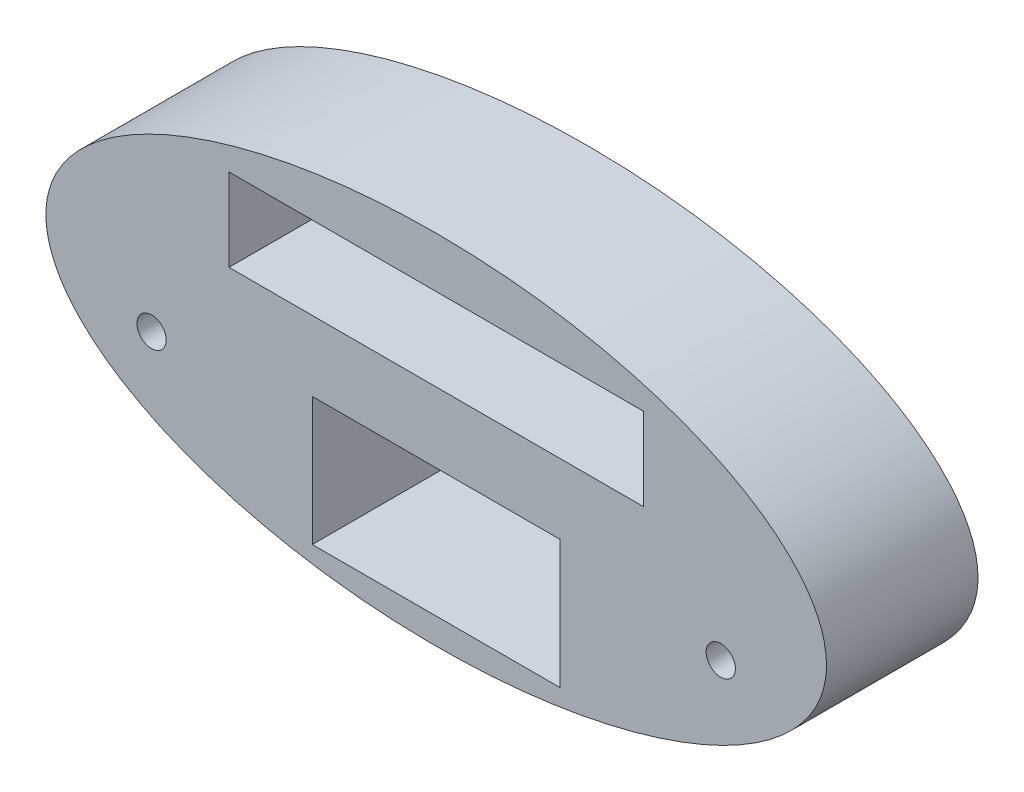
from build123d import *

# Parameters (mm, degrees)
SKETCH1_RX          = 240
SKETCH1_RY          = 110
BOSS_EXTRUDE1_DEPTH = 93.165
SKETCH10_W          = 254.8
SKETCH10_H          = 50.8
CUT_EXTRUDE5_DEPTH  = 280.963778416
SKETCH13_W          = 152.4
SKETCH13_H          = 78.9
CUT_EXTRUDE7_DEPTH  = 280.963778416
SKETCH12_R          = 9
CUT_EXTRUDE8_DEPTH  = 280.963778416


with BuildPart() as part:
    # Sketch1 → Boss-Extrude1 (new body)
    with BuildSketch(Plane.XY):
        with Locations((0, 0)):
            Ellipse(SKETCH1_RX, SKETCH1_RY)
    extrude(amount=-BOSS_EXTRUDE1_DEPTH)

    # Sketch10 → Cut-Extrude5 (cut, through all)
    with BuildSketch(Plane.XY):
        with Locations((0, 53.5)):
            Rectangle(SKETCH10_W, SKETCH10_H)
    extrude(amount=-CUT_EXTRUDE5_DEPTH, mode=Mode.SUBTRACT)

    # Sketch13 → Cut-Extrude7 (cut, through all)
    with BuildSketch(Plane.XY):
        with Locations((0, -54.45)):
            Rectangle(SKETCH13_W, SKETCH13_H)
    extrude(amount=-CUT_EXTRUDE7_DEPTH, mode=Mode.SUBTRACT)

    # Sketch12 → Cut-Extrude8 (cut, through all)
    with BuildSketch(Plane.XY):
        with Locations((175, -30)):
            Circle(SKETCH12_R)
        with Locations(Location((-175, -30, 0), (0, 0, 180))):
            Circle(SKETCH12_R)
    extrude(amount=-CUT_EXTRUDE8_DEPTH, mode=Mode.SUBTRACT)


solid = part.part
